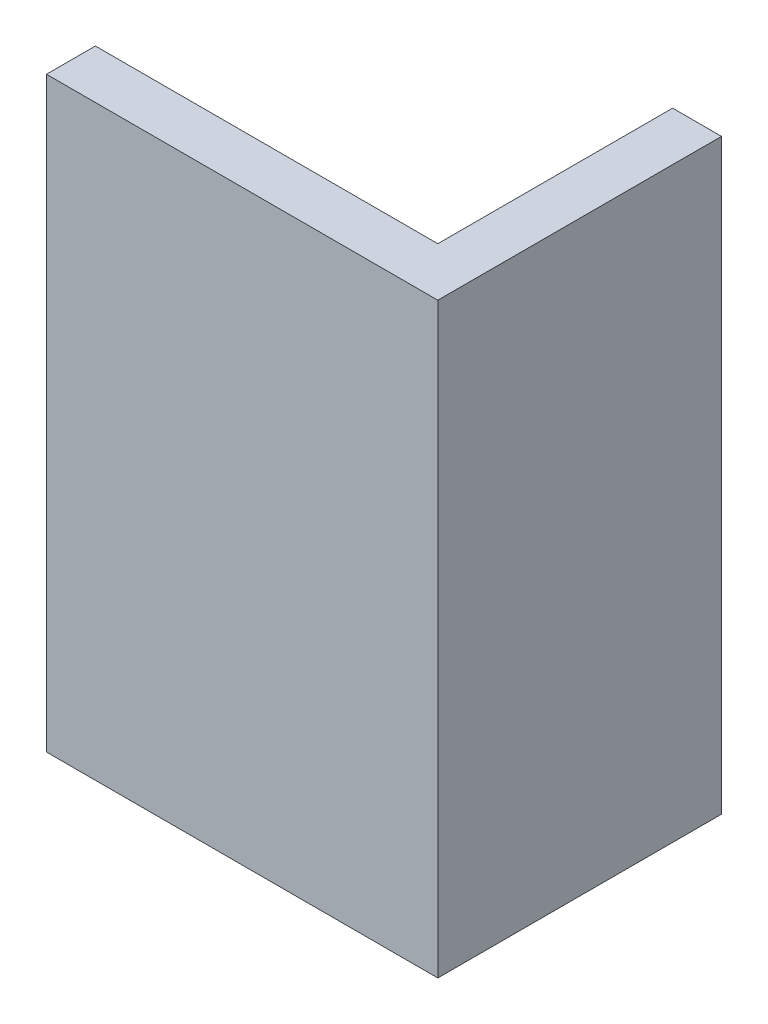
from build123d import *

# Parameters (mm, degrees)
BOSS_EXTRUDE1_DEPTH = 38.1


with BuildPart() as part:
    # Sketch1 → Boss-Extrude1 (new body)
    with BuildSketch(Plane(origin=(0, 0, 0), x_dir=(1, 0, 0), z_dir=(0, 1, 0))):
        Polygon((0, 0), (0, 18.415), (-3.175, 18.415), (-3.175, 3.175), (-25.4, 3.175), (-25.4, 0), align=None)
    extrude(amount=BOSS_EXTRUDE1_DEPTH)


solid = part.part
